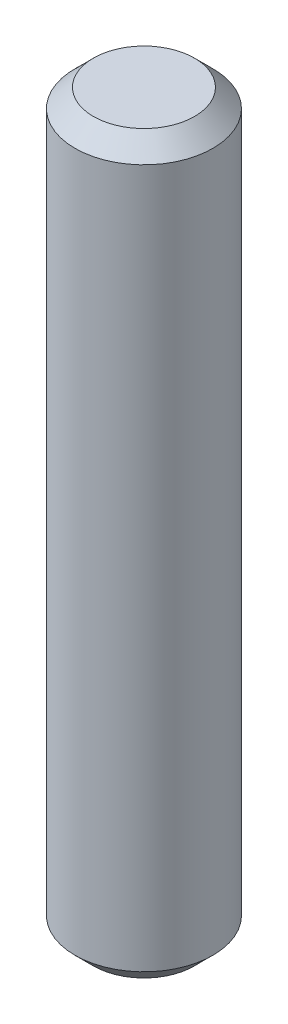
from build123d import *

# Parameters (mm, degrees)
SKETCH1_R           = 0.75
BOSS_EXTRUDE1_DEPTH = 8
CHAMFER1_SIZE       = 0.2


with BuildPart() as part:
    # Sketch1 → Boss-Extrude1 (new body)
    with BuildSketch(Plane(origin=(0, 0, 0), x_dir=(1, 0, 0), z_dir=(0, 1, 0))):
        with Locations(Location((0, 0, 0), (0, 0, 270))):
            Circle(SKETCH1_R)
    extrude(amount=BOSS_EXTRUDE1_DEPTH)

    # Chamfer1
    chamfer1_edges = [part.edges().sort_by_distance(p)[0] for p in [
        (0, 0, -0.75),
        (0, 8, -0.75),
    ]]
    chamfer(chamfer1_edges, length=CHAMFER1_SIZE)


solid = part.part
